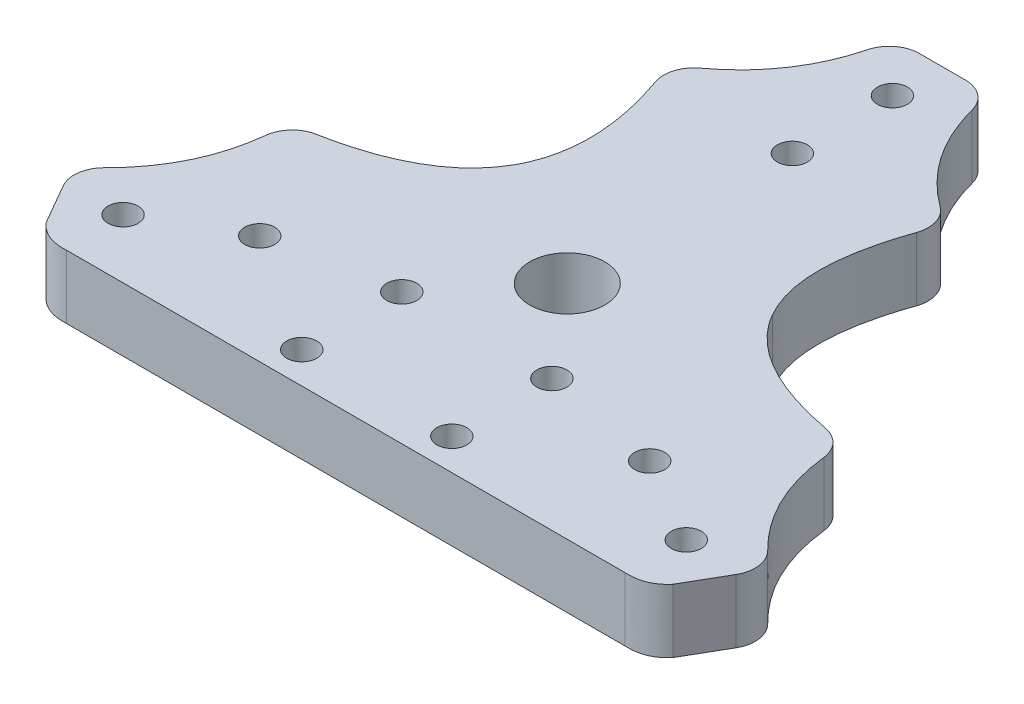
from build123d import *

# Parameters (mm, degrees)
SKETCH1_R           = 7.5
SKETCH1_R_2         = 3
BOSS_EXTRUDE1_DEPTH = 12.7


with BuildPart() as part:
    # Sketch1 → Boss-Extrude1 (new body)
    with BuildSketch(Plane(origin=(0, 0, 0), x_dir=(1, 0, 0), z_dir=(0, 1, 0))):
        with BuildLine():
            Line((4.628728323, 75), (-4.628728323, 75))
            ThreePointArc((-4.628728323, 75), (-8.298056729, 73.747212766), (-10.435089207, 70.512009682))
            add(Edge.make_bspline(
                [(-10.435089207, 70.512009682), (-11.436889623, 66.664934619), (-14.691827535, 59.170334198), (-20.319154818, 53.251718644), (-23.989109736, 50.544662785)],
                knots=[0.130554933, 0.130554933, 0.130554933, 0.130554933, 0.477565762, 0.872598063, 0.872598063, 0.872598063, 0.872598063], degree=3))
            ThreePointArc((-23.989109736, 50.544662785), (-26.161679176, 47.482134252), (-26.088483789, 43.727965713))
            add(Edge.make_bspline(
                [(-26.088483789, 43.727965713), (-23.983802584, 37.735198712), (-21.861167747, 26.954437426), (-23.911988058, 18.58322157), (-25.980762, 15)],
                knots=[0.052697527, 0.052697527, 0.052697527, 0.052697527, 0.276348764, 0.5, 0.5, 0.5, 0.5], degree=3))
            add(Edge.make_bspline(
                [(-50.913771074, 0.729306865), (-44.671541988, 1.902983), (-34.273811388, 5.455107991), (-28.049535938, 11.416778424), (-25.980762, 15)],
                knots=[0.052697527, 0.052697527, 0.052697527, 0.052697527, 0.276348763, 0.5, 0.5, 0.5, 0.5], degree=3))
            ThreePointArc((-50.913771074, 0.729306865), (-54.201574082, -1.084388344), (-55.767516863, -4.497152931))
            add(Edge.make_bspline(
                [(-66.282736261, -26.218952497), (-63.451971733, -23.427830356), (-58.58892633, -16.861671221), (-56.276918547, -9.028955057), (-55.767516863, -4.497152931)],
                knots=[0.130554933, 0.130554933, 0.130554933, 0.130554933, 0.477565762, 0.872598064, 0.872598064, 0.872598064, 0.872598064], degree=3))
            ThreePointArc((-66.282736261, -26.218952497), (-68.015988078, -29.687278454), (-67.266269445, -33.491403685))
            Line((-67.266269445, -33.491403685), (-62.637541122, -41.508596315))
            add(Edge.make_bspline(
                [(-62.637541122, -41.508596315), (-60.110445807, -44.518882553), (-55.847647053, -44.293057185)],
                knots=[0, 0, 0, 1, 1, 1], degree=2))
            Line((-55.847647053, -44.293057185), (55.847647053, -44.293057185))
            add(Edge.make_bspline(
                [(62.637541122, -41.508596315), (60.110445807, -44.518882553), (55.847647053, -44.293057185)],
                knots=[0, 0, 0, 1, 1, 1], degree=2))
            Line((62.637541122, -41.508596315), (67.266269445, -33.491403685))
            ThreePointArc((67.266269445, -33.491403685), (68.015988078, -29.687278454), (66.282736261, -26.218952497))
            add(Edge.make_bspline(
                [(66.282736261, -26.218952497), (63.451971733, -23.427830356), (58.58892633, -16.861671221), (56.276918547, -9.028955057), (55.767516863, -4.497152931)],
                knots=[0.130554933, 0.130554933, 0.130554933, 0.130554933, 0.477565762, 0.872598064, 0.872598064, 0.872598064, 0.872598064], degree=3))
            ThreePointArc((55.767516863, -4.497152931), (54.201574082, -1.084388344), (50.913771074, 0.729306865))
            add(Edge.make_bspline(
                [(50.913771074, 0.729306865), (44.671541988, 1.902983), (34.273811388, 5.455107991), (28.049535938, 11.416778424), (25.980762, 15)],
                knots=[0.052697527, 0.052697527, 0.052697527, 0.052697527, 0.276348763, 0.5, 0.5, 0.5, 0.5], degree=3))
            add(Edge.make_bspline(
                [(26.088483789, 43.727965713), (23.983802584, 37.735198712), (21.861167747, 26.954437426), (23.911988058, 18.58322157), (25.980762, 15)],
                knots=[0.052697527, 0.052697527, 0.052697527, 0.052697527, 0.276348764, 0.5, 0.5, 0.5, 0.5], degree=3))
            ThreePointArc((26.088483789, 43.727965713), (26.161679176, 47.482134252), (23.989109736, 50.544662785))
            add(Edge.make_bspline(
                [(10.435089207, 70.512009682), (11.436889623, 66.664934619), (14.691827535, 59.170334198), (20.319154818, 53.251718644), (23.989109736, 50.544662785)],
                knots=[0.130554933, 0.130554933, 0.130554933, 0.130554933, 0.477565762, 0.872598063, 0.872598063, 0.872598063, 0.872598063], degree=3))
            ThreePointArc((10.435089207, 70.512009682), (8.298056729, 73.747212766), (4.628728323, 75))
        make_face()
        with Locations(Location((0, 0, 0), (0, 0, 270))):
            Circle(SKETCH1_R, mode=Mode.SUBTRACT)
        with Locations(Location((0, 65, 0), (0, 0, 270))):
            Circle(SKETCH1_R_2, mode=Mode.SUBTRACT)
        with Locations(Location((0, 45, 0), (0, 0, 270))):
            Circle(SKETCH1_R_2, mode=Mode.SUBTRACT)
        with Locations(Location((56.291651246, -32.5, 0), (0, 0, 270))):
            Circle(SKETCH1_R_2, mode=Mode.SUBTRACT)
        with Locations(Location((38.97114317, -22.5, 0), (0, 0, 270))):
            Circle(SKETCH1_R_2, mode=Mode.SUBTRACT)
        with Locations(Location((-56.291651246, -32.5, 0), (0, 0, 270))):
            Circle(SKETCH1_R_2, mode=Mode.SUBTRACT)
        with Locations(Location((-38.97114317, -22.5, 0), (0, 0, 270))):
            Circle(SKETCH1_R_2, mode=Mode.SUBTRACT)
        with Locations(Location((-15.075454508, -18, 0), (0, 0, 270))):
            Circle(SKETCH1_R_2, mode=Mode.SUBTRACT)
        with Locations(Location((-15.075454508, -38, 0), (0, 0, 270))):
            Circle(SKETCH1_R_2, mode=Mode.SUBTRACT)
        with Locations(Location((14.924545492, -38, 0), (0, 0, 270))):
            Circle(SKETCH1_R_2, mode=Mode.SUBTRACT)
        with Locations(Location((14.924545492, -18, 0), (0, 0, 270))):
            Circle(SKETCH1_R_2, mode=Mode.SUBTRACT)
    extrude(amount=BOSS_EXTRUDE1_DEPTH)


solid = part.part
